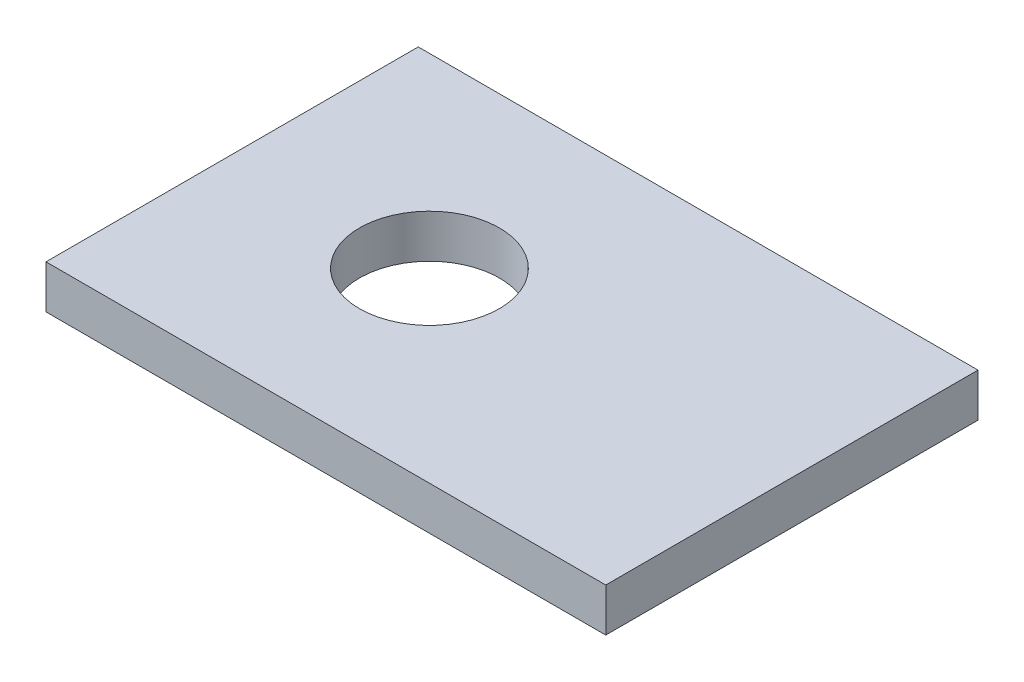
from build123d import *

# Parameters (mm, degrees)
SKETCH1_W           = 20
SKETCH1_H           = 1.55
BOSS_EXTRUDE1_DEPTH = 13.3
SKETCH2_R           = 2.5
CUT_EXTRUDE1_DEPTH  = 10


with BuildPart() as part:
    # Sketch1 → Boss-Extrude1 (new body)
    with BuildSketch(Plane.XY):
        with Locations((10, -0.775)):
            Rectangle(SKETCH1_W, SKETCH1_H)
    extrude(amount=BOSS_EXTRUDE1_DEPTH)

    # Sketch2 → Cut-Extrude1 (cut)
    with BuildSketch(Plane(origin=(0, 0, 0), x_dir=(1, 0, 0), z_dir=(0, 1, 0))):
        with Locations(Location((7.05, -6.65, 0), (0, 0, 270))):
            Circle(SKETCH2_R)
    extrude(amount=-CUT_EXTRUDE1_DEPTH, mode=Mode.SUBTRACT)


solid = part.part
